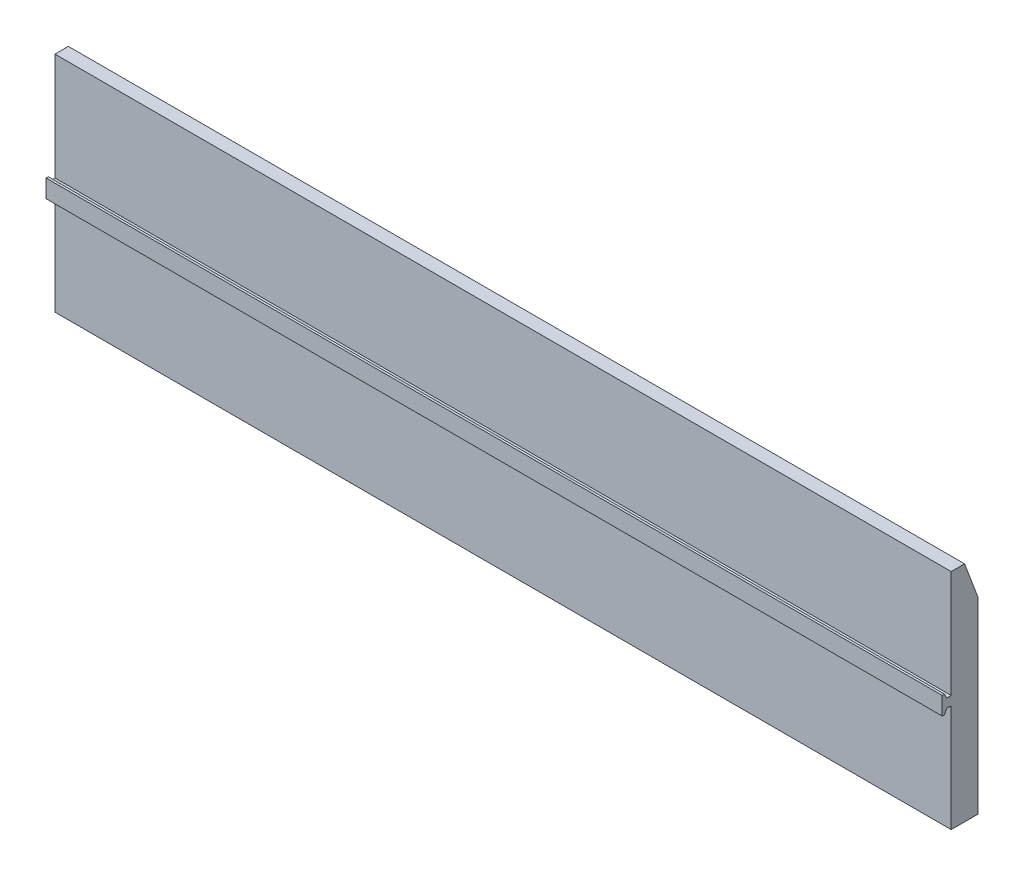
from build123d import *

# Parameters (mm, degrees)
EXTRUDE_1_DEPTH          = 1002.5
CUT_EXTRUDE_1_DEPTH      = 1058.062557278
CUT_EXTRUDE_1_DEPTH_BACK = 1058.062557278
SKETCH_2_W               = 400
SKETCH_2_H               = 185
CUT_EXTRUDE_2_DEPTH      = 1058.062557278
CUT_EXTRUDE_2_DEPTH_BACK = 1058.062557278
SKETCH_3_W               = 150
SKETCH_3_H               = 185
CUT_EXTRUDE_3_DEPTH      = 1058.062557278
CUT_EXTRUDE_3_DEPTH_BACK = 1058.062557278
SKETCH_8_W               = 931.455516369
SKETCH_8_H               = 180.779532171
CUT_EXTRUDE_4_DEPTH      = 1058.062557278
CUT_EXTRUDE_4_DEPTH_BACK = 1058.062557278
SKETCH_9_R               = 12


with BuildPart() as part:
    # 草图1 → 凸台-拉伸1 (new body)
    with BuildSketch(Plane(origin=(1027.5, 0, 0), x_dir=(0, 0, -1), z_dir=(1, 0, 0))):
        Polygon((-105, 300), (-105, 180), (-110, 180), (-112.5, 185), (-115, 185), (-115, 165), (-112.5, 165), (-110, 170), (-105, 170), (-105, 50), (-75, 50), (110, 50), (110, 80), (-75, 80), (-75, 260), (-90, 300), align=None)
    extrude(amount=-EXTRUDE_1_DEPTH)

    # 草图2 → 切除-拉伸1 (cut, two sides: drawn at the far end of the back side and taken through both)
    with BuildSketch(Plane(origin=(0, 80, 0), x_dir=(1, 0, 0), z_dir=(0, 1, 0)).offset(-CUT_EXTRUDE_1_DEPTH_BACK)):
        with Locations((526.25, 17.5)):
            Rectangle(SKETCH_2_W, SKETCH_2_H)
    extrude(amount=CUT_EXTRUDE_1_DEPTH + CUT_EXTRUDE_1_DEPTH_BACK, mode=Mode.SUBTRACT)

    # 草图3 → 切除-拉伸2 (cut, two sides: drawn at the far end of the back side and taken through both)
    with BuildSketch(Plane(origin=(0, 80, 0), x_dir=(1, 0, 0), z_dir=(0, 1, 0)).offset(-CUT_EXTRUDE_2_DEPTH_BACK)):
        with Locations((100, 17.5)):
            Rectangle(SKETCH_3_W, SKETCH_3_H)
        with Locations((952.5, 17.5)):
            Rectangle(SKETCH_3_W, SKETCH_3_H)
    extrude(amount=CUT_EXTRUDE_2_DEPTH + CUT_EXTRUDE_2_DEPTH_BACK, mode=Mode.SUBTRACT)

    # 草图8 → 切除-拉伸3 (cut, two sides: drawn at the far end of the back side and taken through both)
    with BuildSketch(Plane(origin=(0, 80, 0), x_dir=(1, 0, 0), z_dir=(0, 1, 0)).offset(-CUT_EXTRUDE_3_DEPTH_BACK)):
        with Locations((511.159415891, 135.389766086)):
            Rectangle(SKETCH_8_W, SKETCH_8_H)
    extrude(amount=CUT_EXTRUDE_3_DEPTH + CUT_EXTRUDE_3_DEPTH_BACK, mode=Mode.SUBTRACT)

    # 草图9 → 切除-拉伸4 (cut, two sides: drawn at the far end of the back side and taken through both)
    with BuildSketch(Plane(origin=(0, 80, 0), x_dir=(1, 0, 0), z_dir=(0, 1, 0)).offset(-CUT_EXTRUDE_4_DEPTH_BACK)):
        with Locations(Location((215, -15, 0), (0, 0, 270))):
            Circle(SKETCH_9_R)
        with Locations(Location((286.25, -15, 0), (0, 0, 270))):
            Circle(SKETCH_9_R)
        with Locations(Location((766.25, -15, 0), (0, 0, 270))):
            Circle(SKETCH_9_R)
        with Locations(Location((837.5, -15, 0), (0, 0, 270))):
            Circle(SKETCH_9_R)
    extrude(amount=CUT_EXTRUDE_4_DEPTH + CUT_EXTRUDE_4_DEPTH_BACK, mode=Mode.SUBTRACT)


solid = part.part
